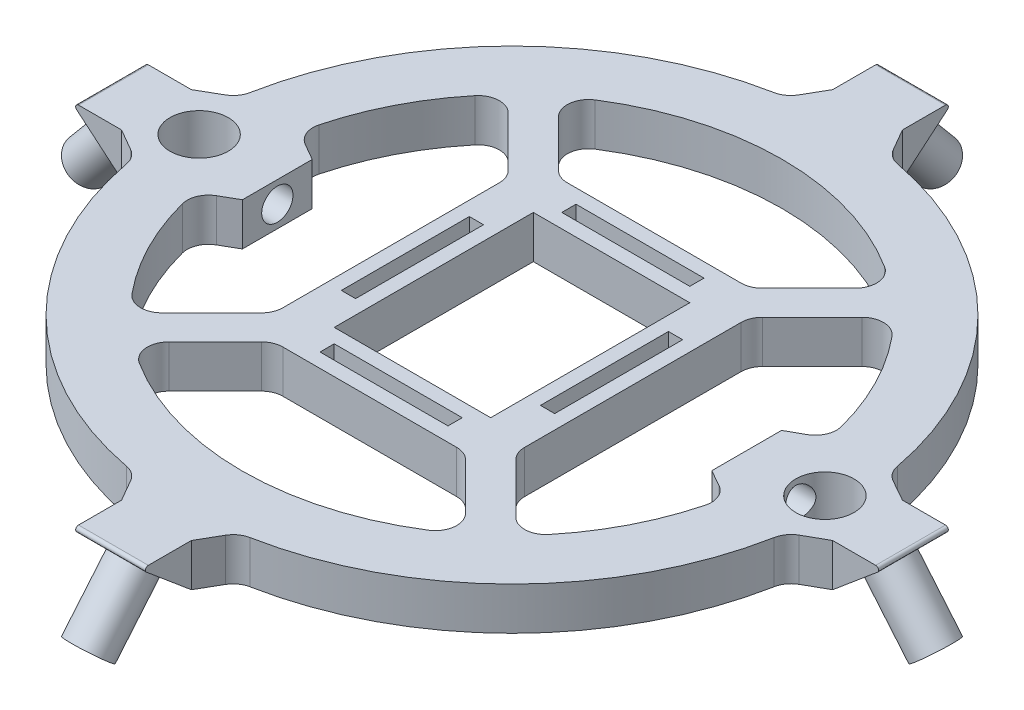
from build123d import *

# Parameters (mm, degrees)
SKETCH1_W                = 43.18
SKETCH1_H                = 50.8
SKETCH1_W_2              = 27.94
SKETCH1_H_2              = 35.56
EXTRUDE_THIN1_DEPTH      = 3.81
SKETCH2_R                = 5.207
BOSS_EXTRUDE1_DEPTH      = 3.81
FILLET3_R                = 3.81
CUT_EXTRUDE2_REACH       = 92.125
SKETCH6_W                = 22.86
SKETCH6_H                = 2.54
SKETCH6_W_2              = 2.54
SKETCH6_H_2              = 22.86
CUT_EXTRUDE5_REACH       = 108.241
CUT_EXTRUDE5_END_RADIUS  = 5.207
SKETCH7_R                = 2.794
CUT_EXTRUDE6_REACH       = 108.241
CUT_EXTRUDE6_END_RADIUS  = 5.207
SKETCH8_R                = 2.794
BOSS_EXTRUDE3_DEPTH      = 6.232496
BOSS_EXTRUDE3_DEPTH_BACK = 6.232496
BOSS_EXTRUDE5_DEPTH      = 6.232496
BOSS_EXTRUDE5_DEPTH_BACK = 6.232496
BOSS_EXTRUDE6_DEPTH      = 6.232496
BOSS_EXTRUDE6_DEPTH_BACK = 6.232496
FILLET2_R                = 0.508
SKETCH10_R               = 3.81
SKETCH10_R_2             = 2.7305
BOSS_EXTRUDE4_DEPTH      = 12.7
CIRPATTERN2_COUNT        = 4


with BuildPart() as part:
    # Sketch1 → Extrude-Thin1 (new, symmetric)
    with BuildSketch(Plane(origin=(0, 0, 0), x_dir=(1, 0, 0), z_dir=(0, 1, 0))):
        Rectangle(SKETCH1_W, SKETCH1_H)
        Rectangle(SKETCH1_W_2, SKETCH1_H_2, mode=Mode.SUBTRACT)
    extrude(amount=EXTRUDE_THIN1_DEPTH, both=True)

    # Sketch2 → Boss-Extrude1 (add, symmetric)
    with BuildSketch(Plane(origin=(0, 0, 0), x_dir=(1, 0, 0), z_dir=(0, 1, 0))):
        with BuildLine():
            Line((-58.1025, 9.348744234), (-63.5, 6.232496156))
            Line((-63.5, 6.232496156), (-63.5, -6.232496156))
            Line((-63.5, -6.232496156), (-58.1025, -9.348744234))
            ThreePointArc((-58.1025, -9.348744234), (-41.613096046, -41.613096046), (-9.348744234, -58.1025))
            Line((-9.348744234, -58.1025), (-6.232496156, -63.5))
            Line((-6.232496156, -63.5), (6.232496156, -63.5))
            Line((6.232496156, -63.5), (9.348744234, -58.1025))
            ThreePointArc((9.348744234, -58.1025), (41.640876302, -41.585297232), (58.114934495, -9.27113335))
            Line((58.114934495, -9.27113335), (63.5, -6.232496156))
            Line((63.5, -6.232496156), (63.5, 6.232496156))
            Line((63.5, 6.232496156), (58.114934495, 9.27113335))
            ThreePointArc((58.114934495, 9.27113335), (41.640876302, 41.585297232), (9.348744234, 58.1025))
            Line((9.348744234, 58.1025), (6.232496156, 63.5))
            Line((6.232496156, 63.5), (-6.232496156, 63.5))
            Line((-6.232496156, 63.5), (-9.348744234, 58.1025))
            ThreePointArc((-9.348744234, 58.1025), (-41.613096046, 41.613096046), (-58.1025, 9.348744234))
        make_face()
        with Locations(Location((55.88, 0, 0), (0, 0, 90))):
            Circle(SKETCH2_R, mode=Mode.SUBTRACT)
        with Locations(Location((-55.88, 0, 0), (0, 0, 90))):
            Circle(SKETCH2_R, mode=Mode.SUBTRACT)
        with BuildLine():
            Line((47.325970274, -9.254788633), (41.91, -6.232496156))
            Line((41.91, -6.232496156), (41.91, 6.232496156))
            Line((41.91, 6.232496156), (47.325970274, 9.254788633))
            ThreePointArc((47.325970274, 9.254788633), (42.677515071, 22.450574209), (34.436744865, 33.756616805))
            Line((34.436744865, 33.756616805), (21.59, 20.909871939))
            Line((21.59, 20.909871939), (17.099871939, 25.4))
            Line((17.099871939, 25.4), (29.694821197, 37.994949258))
            ThreePointArc((29.694821197, 37.994949258), (0, 48.222386658), (-29.694821197, 37.994949258))
            Line((-29.694821197, 37.994949258), (-17.099871939, 25.4))
            Line((-17.099871939, 25.4), (-21.59, 20.909871939))
            Line((-21.59, 20.909871939), (-34.436744865, 33.756616805))
            ThreePointArc((-34.436744865, 33.756616805), (-42.65520429, 22.492934935), (-47.3075, 9.348744234))
            Line((-47.3075, 9.348744234), (-41.91, 6.232496156))
            Line((-41.91, 6.232496156), (-41.91, -6.232496156))
            Line((-41.91, -6.232496156), (-47.3075, -9.348744234))
            ThreePointArc((-47.3075, -9.348744234), (-42.65520429, -22.492934935), (-34.436744865, -33.756616805))
            Line((-34.436744865, -33.756616805), (-21.59, -20.909871939))
            Line((-21.59, -20.909871939), (-17.099871939, -25.4))
            Line((-17.099871939, -25.4), (-29.694821197, -37.994949258))
            ThreePointArc((-29.694821197, -37.994949258), (0, -48.222386658), (29.694821197, -37.994949258))
            Line((29.694821197, -37.994949258), (17.099871939, -25.4))
            Line((17.099871939, -25.4), (21.59, -20.909871939))
            Line((21.59, -20.909871939), (34.436744865, -33.756616805))
            ThreePointArc((34.436744865, -33.756616805), (42.677515071, -22.450574209), (47.325970274, -9.254788633))
        make_face(mode=Mode.SUBTRACT)
    extrude(amount=BOSS_EXTRUDE1_DEPTH, both=True)

    # Fillet3
    fillet3_edges = [part.edges().sort_by_distance(p)[0] for p in [
        (-29.694821197, 0, -37.994949258),
        (29.694821197, 0, -37.994949258),
        (17.099871939, 0, -25.4),
        (21.59, 0, -20.909871939),
        (34.436744865, 0, -33.756616805),
        (47.325970274, 0, -9.254788633),
        (47.325970274, 0, 9.254788633),
        (34.436744865, 0, 33.756616805),
        (21.59, 0, 20.909871939),
        (17.099871939, 0, 25.4),
        (29.694821197, 0, 37.994949258),
        (-29.694821197, 0, 37.994949258),
        (-17.099871939, 0, 25.4),
        (-21.59, 0, 20.909871939),
        (-34.436744865, 0, 33.756616805),
        (-47.3075, 0, 9.348744234),
        (-47.3075, 0, -9.348744234),
        (-34.436744865, 0, -33.756616805),
        (-21.59, 0, -20.909871939),
        (58.114934495, 0, -9.27113335),
        (9.348744234, 0, -58.1025),
        (-9.348744234, 0, -58.1025),
        (-58.1025, 0, -9.348744234),
        (-58.1025, 0, 9.348744234),
        (-9.348744234, 0, 58.1025),
        (9.348744234, 0, 58.1025),
        (58.114934495, 0, 9.27113335),
        (-17.099871939, 0, -25.4),
    ]]
    fillet(fillet3_edges, radius=FILLET3_R)

    # Sketch6 → Cut-Extrude2 (cut, up to next)
    with BuildSketch(Plane(origin=(0, 3.81, 0), x_dir=(1, 0, 0), z_dir=(0, 1, 0)), mode=Mode.PRIVATE) as cut_extrude2_sk1:
        with Locations((0, -21.59)):
            Rectangle(SKETCH6_W, SKETCH6_H)
    cut_extrude2_tool1 = extrude(cut_extrude2_sk1.sketch, amount=-CUT_EXTRUDE2_REACH, mode=Mode.PRIVATE) & part.part
    # Sketch6 → Cut-Extrude2 (cut, up to next)
    with BuildSketch(Plane(origin=(0, 3.81, 0), x_dir=(1, 0, 0), z_dir=(0, 1, 0)), mode=Mode.PRIVATE) as cut_extrude2_sk2:
        with Locations((0, 21.59)):
            Rectangle(SKETCH6_W, SKETCH6_H)
    cut_extrude2_tool2 = extrude(cut_extrude2_sk2.sketch, amount=-CUT_EXTRUDE2_REACH, mode=Mode.PRIVATE) & part.part
    # Sketch6 → Cut-Extrude2 (cut, up to next)
    with BuildSketch(Plane(origin=(0, 3.81, 0), x_dir=(1, 0, 0), z_dir=(0, 1, 0)), mode=Mode.PRIVATE) as cut_extrude2_sk3:
        with Locations((-17.78, 0)):
            Rectangle(SKETCH6_W_2, SKETCH6_H_2)
    cut_extrude2_tool3 = extrude(cut_extrude2_sk3.sketch, amount=-CUT_EXTRUDE2_REACH, mode=Mode.PRIVATE) & part.part
    # Sketch6 → Cut-Extrude2 (cut, up to next)
    with BuildSketch(Plane(origin=(0, 3.81, 0), x_dir=(1, 0, 0), z_dir=(0, 1, 0)), mode=Mode.PRIVATE) as cut_extrude2_sk4:
        with Locations((17.78, 0)):
            Rectangle(SKETCH6_W_2, SKETCH6_H_2)
    cut_extrude2_tool4 = extrude(cut_extrude2_sk4.sketch, amount=-CUT_EXTRUDE2_REACH, mode=Mode.PRIVATE) & part.part
    add(cut_extrude2_tool1.solids().sort_by_distance((0, 3.81, 21.59))[0], mode=Mode.SUBTRACT)
    add(cut_extrude2_tool2.solids().sort_by_distance((0, 3.81, -21.59))[0], mode=Mode.SUBTRACT)
    add(cut_extrude2_tool3.solids().sort_by_distance((-17.78, 3.81, 0))[0], mode=Mode.SUBTRACT)
    add(cut_extrude2_tool4.solids().sort_by_distance((17.78, 3.81, 0))[0], mode=Mode.SUBTRACT)

    # Cut-Extrude5: up to this cylinder (the profile starts outside it)
    cut_extrude5_end = Plane(origin=(55.88, 0, 0), z_dir=(0, -1, 0)) * Cylinder(CUT_EXTRUDE5_END_RADIUS, 227.896, mode=Mode.PRIVATE)
    # Sketch7 → Cut-Extrude5 (cut, up to the surface)
    with BuildSketch(Plane(origin=(21.59, 0, 0), x_dir=(0, 0, -1), z_dir=(1, 0, 0)), mode=Mode.PRIVATE) as cut_extrude5_sk1:
        with Locations(Location((0, 0, 0), (0, 0, 180))):
            Circle(SKETCH7_R)
    cut_extrude5_tool1 = extrude(cut_extrude5_sk1.sketch, amount=CUT_EXTRUDE5_REACH, mode=Mode.PRIVATE) - cut_extrude5_end
    add(cut_extrude5_tool1.solids().sort_by_distance((21.59, 0, 0))[0], mode=Mode.SUBTRACT)

    # Cut-Extrude6: up to this cylinder (the profile starts outside it)
    cut_extrude6_end = Plane(origin=(-55.88, 0, 0), z_dir=(0, -1, 0)) * Cylinder(CUT_EXTRUDE6_END_RADIUS, 227.896, mode=Mode.PRIVATE)
    # Sketch8 → Cut-Extrude6 (cut, up to the surface)
    with BuildSketch(Plane.ZY.offset(21.59), mode=Mode.PRIVATE) as cut_extrude6_sk1:
        Circle(SKETCH8_R)
    cut_extrude6_tool1 = extrude(cut_extrude6_sk1.sketch, amount=CUT_EXTRUDE6_REACH, mode=Mode.PRIVATE) - cut_extrude6_end
    add(cut_extrude6_tool1.solids().sort_by_distance((-21.59, 0, 0))[0], mode=Mode.SUBTRACT)

    # Sketch9 → Boss-Extrude3 (add, two sides: drawn at the far end of the back side and taken through both)
    with BuildSketch(Plane.XY.offset(-BOSS_EXTRUDE3_DEPTH_BACK)):
        Polygon((-63.5, 3.81), (-72.581162376, 3.81), (-63.5, -3.81), align=None)
    extrude(amount=BOSS_EXTRUDE3_DEPTH + BOSS_EXTRUDE3_DEPTH_BACK)

    # Sketch12 → Boss-Extrude5 (add, two sides: drawn at the far end of the back side and taken through both)
    with BuildSketch(Plane(origin=(0, 0, 0), x_dir=(0, 0, -1), z_dir=(1, 0, 0)).offset(-BOSS_EXTRUDE5_DEPTH_BACK)):
        Polygon((-63.5, 3.81), (-72.581162376, 3.81), (-63.5, -3.81), align=None)
        Polygon((63.5, -3.81), (63.5, 3.81), (72.581162376, 3.81), align=None)
    extrude(amount=BOSS_EXTRUDE5_DEPTH + BOSS_EXTRUDE5_DEPTH_BACK)

    # Sketch13 → Boss-Extrude6 (add, two sides: drawn at the far end of the back side and taken through both)
    with BuildSketch(Plane.XY.offset(-BOSS_EXTRUDE6_DEPTH_BACK)):
        Polygon((63.5, -3.81), (63.5, 3.81), (72.581162376, 3.81), align=None)
    extrude(amount=BOSS_EXTRUDE6_DEPTH + BOSS_EXTRUDE6_DEPTH_BACK)

    # Fillet2
    fillet2_edges = [part.edges().sort_by_distance(p)[0] for p in [
        (-72.581162376, 3.81, 0),
        (0, 3.81, 72.581162376),
        (0, 3.81, -72.581162376),
        (72.581162376, 3.81, 0),
    ]]
    fillet(fillet2_edges, radius=FILLET2_R)

    # Sketch10 → Boss-Extrude4 (add)
    with BuildSketch(Plane(origin=(-28.112729129, -33.503445937, 0), x_dir=(0.766044443118975, -0.6427876096865429, 0), z_dir=(-0.6427876096865429, -0.766044443118975, 0))):
        with Locations(Location((-51.424249861, 0, 0), (0, 0, 180))):
            Circle(SKETCH10_R)
        with Locations((-51.424249861, 0)):
            Circle(SKETCH10_R_2, mode=Mode.SUBTRACT)
    boss_extrude4 = extrude(amount=BOSS_EXTRUDE4_DEPTH)

    # CirPattern2: Boss-Extrude4 ×4 about axis
    cirpattern2_axis = Axis((0, 0, 0), (0, 1, 0))
    for i in range(1, CIRPATTERN2_COUNT):
        add(boss_extrude4.rotate(cirpattern2_axis, i * 360 / CIRPATTERN2_COUNT))


solid = part.part
